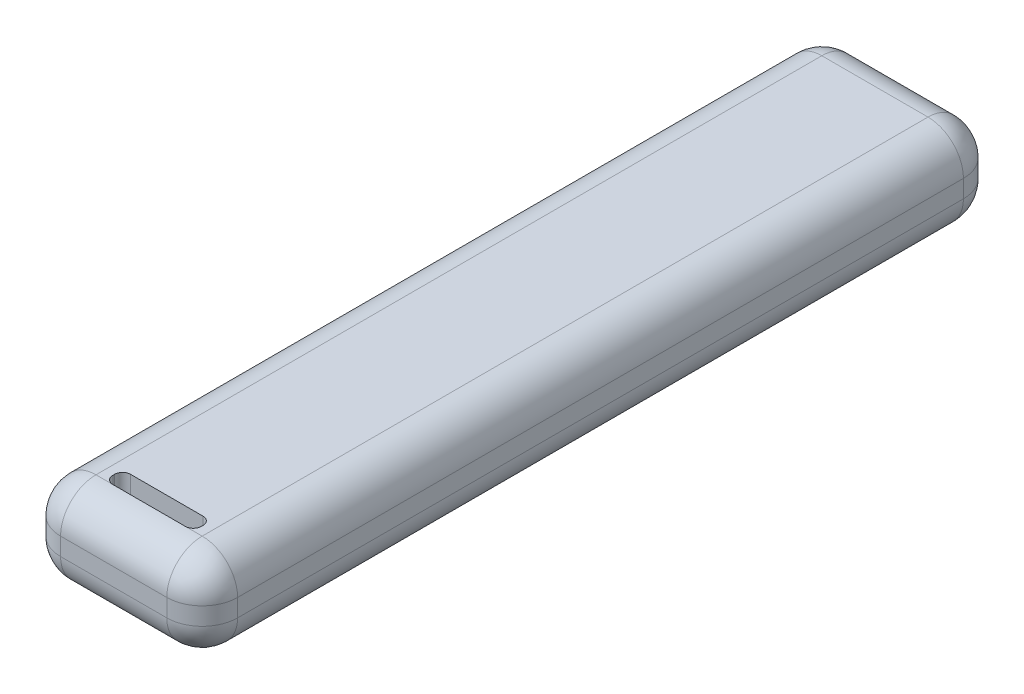
from build123d import *

# Parameters (mm, degrees)
SKETCH1_W           = 10
SKETCH1_H           = 5
BOSS_EXTRUDE1_DEPTH = 45
FILLET1_R           = 2
CUT_EXTRUDE1_DEPTH  = 10


with BuildPart() as part:
    # Sketch1 → Boss-Extrude1 (new body)
    with BuildSketch(Plane.XY):
        Rectangle(SKETCH1_W, SKETCH1_H)
    extrude(amount=BOSS_EXTRUDE1_DEPTH)

    # Fillet1
    fillet1_edges = [part.edges().sort_by_distance(p)[0] for p in [
        (5, 0, 0),
        (0, -2.5, 0),
        (-5, 0, 0),
        (0, 2.5, 0),
        (0, 2.5, 45),
        (5, 0, 45),
        (0, -2.5, 45),
        (-5, 0, 45),
        (-5, 2.5, 22.5),
        (-5, -2.5, 22.5),
        (5, -2.5, 22.5),
        (5, 2.5, 22.5),
    ]]
    fillet(fillet1_edges, radius=FILLET1_R)

    # Sketch2 → Cut-Extrude1 (cut)
    with BuildSketch(Plane.XZ.offset(2.5)):
        with BuildLine():
            Line((2.05, 42), (-2.05, 42))
            ThreePointArc((-2.05, 42), (-2.368198052, 42.131801948), (-2.5, 42.45))
            Line((-2.5, 42.45), (-2.5, 42.55))
            ThreePointArc((-2.5, 42.55), (-2.368198052, 42.868198052), (-2.05, 43))
            Line((-2.05, 43), (2.05, 43))
            ThreePointArc((2.05, 43), (2.368198052, 42.868198052), (2.5, 42.55))
            Line((2.5, 42.55), (2.5, 42.45))
            ThreePointArc((2.5, 42.45), (2.368198052, 42.131801948), (2.05, 42))
        make_face()
    extrude(amount=-CUT_EXTRUDE1_DEPTH, mode=Mode.SUBTRACT)


solid = part.part
